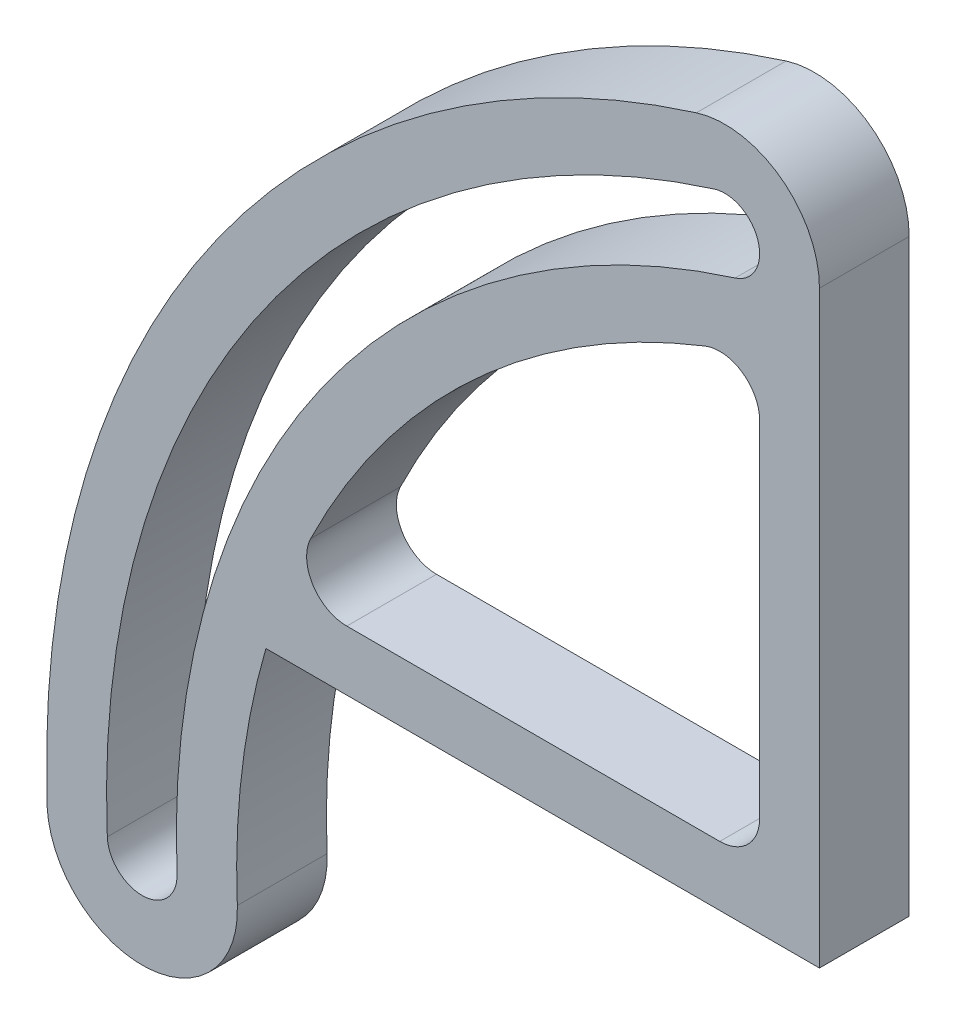
from build123d import *

# Parameters (mm, degrees)
BOSS_EXTRUDE1_DEPTH = 4.5


with BuildPart() as part:
    # Sketch1 → Boss-Extrude1 (new body)
    with BuildSketch(Plane.XY):
        with BuildLine():
            Line((-2.6366524, -1.149368065), (25.121954618, -1.149368065))
            Line((25.121954618, -1.149368065), (25.121954618, 28.374931045))
            ThreePointArc((25.121954618, 28.374931045), (23.183396216, 32.203546479), (18.950040453, 32.907111548))
            ThreePointArc((18.950040453, 32.907111548), (-5.035386419, 15.47250193), (-13.605299783, -12.914517987))
            ThreePointArc((-13.605299783, -12.914517987), (-8.8972368, -18.005680822), (-4.0694524, -13.027900808))
            ThreePointArc((-4.0694524, -13.027900808), (-3.836748935, -7.030290497), (-2.6366524, -1.149368065))
        make_face()
        with BuildLine():
            Line((1.419098269, 1.850631935), (20.121954618, 1.850631935))
            ThreePointArc((20.121954618, 1.850631935), (21.53616818, 2.436418372), (22.121954618, 3.850631935))
            Line((22.121954618, 3.850631935), (22.121954618, 21.135325995))
            ThreePointArc((22.121954618, 21.135325995), (21.249580029, 22.78713135), (19.393493686, 22.997943688))
            ThreePointArc((19.393493686, 22.997943688), (7.78243837, 15.73507518), (-0.390986112, 4.745944333))
            ThreePointArc((-0.390986112, 4.745944333), (-0.288183148, 2.79674616), (1.419098269, 1.850631935))
        make_face(mode=Mode.SUBTRACT)
        with BuildLine():
            ThreePointArc((19.848091505, 30.044681757), (-2.729641043, 13.536951641), (-10.588882657, -13.30502075))
            ThreePointArc((-10.588882657, -13.30502075), (-8.766141749, -14.979122175), (-7.092040324, -13.156381267))
            ThreePointArc((-7.092040324, -13.156381267), (0.134806128, 11.525747423), (20.895817731, 26.705180334))
            ThreePointArc((20.895817731, 26.705180334), (22.041705329, 28.898794159), (19.848091505, 30.044681757))
        make_face(mode=Mode.SUBTRACT)
    extrude(amount=BOSS_EXTRUDE1_DEPTH)


solid = part.part
